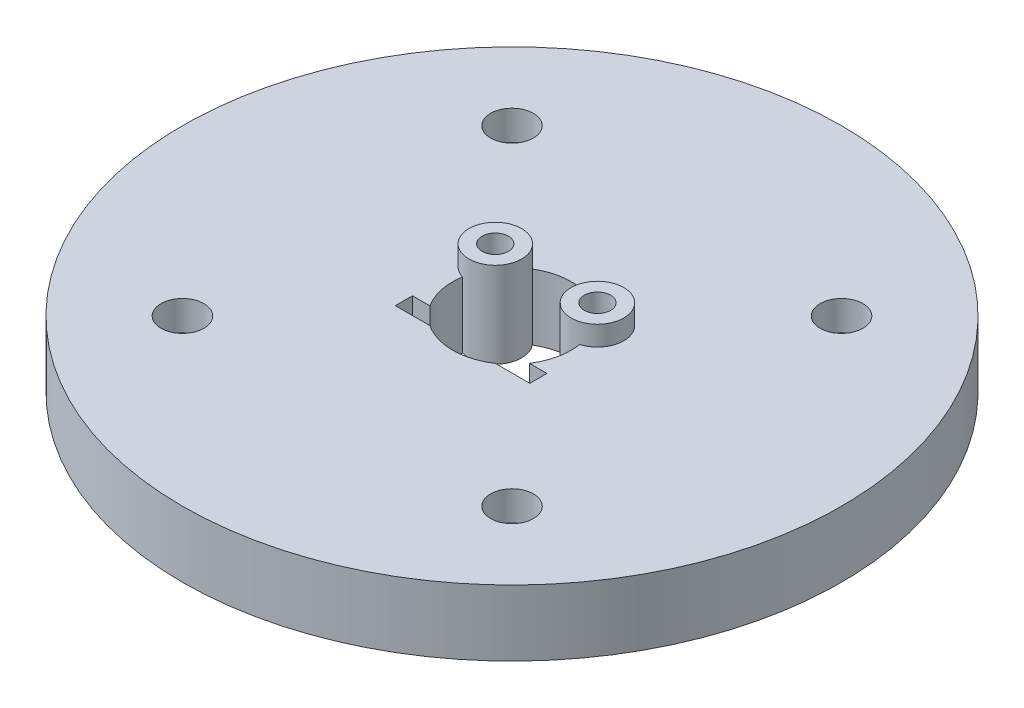
from build123d import *

# Parameters (mm, degrees)
SKIZZE1_R                       = 50
AUFSATZ_LINEAR_AUSTRAGEN1_DEPTH = 10
SKIZZE2_R                       = 1.7
SCHNITT_LINEAR_AUSTRAGEN1_DEPTH = 10
SKIZZE3_R                       = 3.25
SCHNITT_LINEAR_AUSTRAGEN2_DEPTH = 4.5
SKIZZE7_R                       = 9
SCHNITT_LINEAR_AUSTRAGEN5_DEPTH = 72.414284285
SKIZZE4_W                       = 20.4
SKIZZE4_H                       = 2.6
SCHNITT_LINEAR_AUSTRAGEN3_DEPTH = 10
AUFSATZ_LINEAR_START            = -10
SKIZZE5_R                       = 4
AUFSATZ_LINEAR_AUSTRAGEN2_DEPTH = 13
SCHNITT_LINEAR_START            = -6
SKIZZE6_R                       = 2
SCHNITT_LINEAR_AUSTRAGEN4_DEPTH = 6


with BuildPart() as part:
    # Skizze1 → Aufsatz-Linear austragen1 (new body)
    with BuildSketch(Plane(origin=(0, 0, 0), x_dir=(1, 0, 0), z_dir=(0, 1, 0))):
        with Locations(Location((0, 0, 0), (0, 0, 270))):
            Circle(SKIZZE1_R)
    extrude(amount=AUFSATZ_LINEAR_AUSTRAGEN1_DEPTH)

    # Skizze2 → Schnitt-Linear austragen1 (cut)
    with BuildSketch(Plane(origin=(0, 10, 0), x_dir=(1, 0, 0), z_dir=(0, 1, 0))):
        with Locations(Location((-25, 25, 0), (0, 0, 270))):
            Circle(SKIZZE2_R)
        with Locations(Location((25, 25, 0), (0, 0, 270))):
            Circle(SKIZZE2_R)
        with Locations(Location((25, -25, 0), (0, 0, 270))):
            Circle(SKIZZE2_R)
        with Locations(Location((-25, -25, 0), (0, 0, 270))):
            Circle(SKIZZE2_R)
    extrude(amount=-SCHNITT_LINEAR_AUSTRAGEN1_DEPTH, mode=Mode.SUBTRACT)

    # Skizze3 → Schnitt-Linear austragen2 (cut)
    with BuildSketch(Plane(origin=(0, 10, 0), x_dir=(1, 0, 0), z_dir=(0, 1, 0))):
        with Locations(Location((-25, 25, 0), (0, 0, 270))):
            Circle(SKIZZE3_R)
        with Locations(Location((25, 25, 0), (0, 0, 270))):
            Circle(SKIZZE3_R)
        with Locations(Location((25, -25, 0), (0, 0, 270))):
            Circle(SKIZZE3_R)
        with Locations(Location((-25, -25, 0), (0, 0, 270))):
            Circle(SKIZZE3_R)
    extrude(amount=-SCHNITT_LINEAR_AUSTRAGEN2_DEPTH, mode=Mode.SUBTRACT)

    # Skizze7 → Schnitt-Linear austragen5 (cut, through all)
    with BuildSketch(Plane.XZ):
        with Locations(Location((0, 0, 0), (0, 0, 270))):
            Circle(SKIZZE7_R)
    extrude(amount=-SCHNITT_LINEAR_AUSTRAGEN5_DEPTH, mode=Mode.SUBTRACT)

    # Skizze4 → Schnitt-Linear austragen3 (cut)
    with BuildSketch(Plane(origin=(0, 10, 0), x_dir=(1, 0, 0), z_dir=(0, 1, 0))):
        with Locations((0, -6.2)):
            Rectangle(SKIZZE4_W, SKIZZE4_H)
    extrude(amount=-SCHNITT_LINEAR_AUSTRAGEN3_DEPTH, mode=Mode.SUBTRACT)

    # Skizze5 → Aufsatz-Linear austragen2 (add)
    # profile 1 of 2: a face of its own
    with BuildSketch(Plane(origin=(0, 10, 0), x_dir=(1, 0, 0), z_dir=(0, 1, 0)).offset(AUFSATZ_LINEAR_START)):
        with Locations(Location((-7.75, 5.215, 0), (0, 0, 38.734407875))):
            Circle(SKIZZE5_R)
        with BuildLine():
            ThreePointArc((-6.220782003, 6.503988874), (-9.409308992, 6.331554373), (-8.368075659, 3.312900507))
            ThreePointArc((-8.368075659, 3.312900507), (-7.466890464, 5.02449468), (-6.220782003, 6.503988874))
        make_face(mode=Mode.SUBTRACT)
    # profile 2 of 2: a face of its own
    with BuildSketch(Plane(origin=(0, 10, 0), x_dir=(1, 0, 0), z_dir=(0, 1, 0)).offset(AUFSATZ_LINEAR_START)):
        with Locations(Location((7.75, 5.215, 0), (0, 0, 141.265592125))):
            Circle(SKIZZE5_R)
        with BuildLine():
            ThreePointArc((8.368075659, 3.312900507), (9.409308992, 6.331554373), (6.220782003, 6.503988874))
            ThreePointArc((6.220782003, 6.503988874), (7.466890464, 5.02449468), (8.368075659, 3.312900507))
        make_face(mode=Mode.SUBTRACT)
    extrude(amount=AUFSATZ_LINEAR_AUSTRAGEN2_DEPTH)

    # Skizze6 → Schnitt-Linear austragen4 (cut)
    with BuildSketch(Plane(origin=(0, 12.999999992, 0), x_dir=(1, 0, 0), z_dir=(0, 1, 0)).offset(SCHNITT_LINEAR_START)):
        with Locations(Location((-7.75, 5.215, 0), (0, 0, 180))):
            Circle(SKIZZE6_R)
        with Locations(Location((7.75, 5.215, 0), (0, 0, 180))):
            Circle(SKIZZE6_R)
    extrude(amount=SCHNITT_LINEAR_AUSTRAGEN4_DEPTH, mode=Mode.SUBTRACT)


solid = part.part
